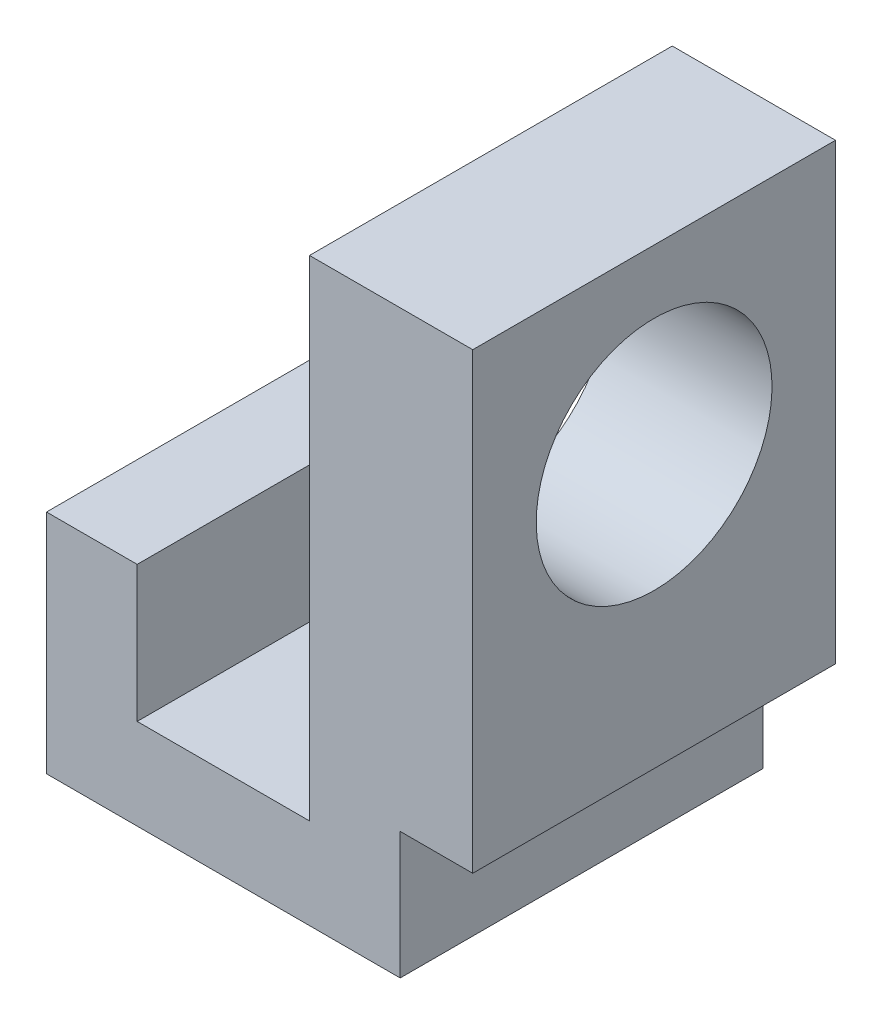
from build123d import *

# Parameters (mm, degrees)
BOSS_EXTRUDE1_DEPTH = 40
SKETCH2_R           = 13
CUT_EXTRUDE1_DEPTH  = 18


with BuildPart() as part:
    # Sketch1 → Boss-Extrude1 (new body)
    with BuildSketch(Plane.XY):
        Polygon((0, 0), (39, 0), (39, 14), (47, 14), (47, 64), (29, 64), (29, 10), (10, 10), (10, 25), (0, 25), align=None)
    extrude(amount=-BOSS_EXTRUDE1_DEPTH)

    # Sketch2 → Cut-Extrude1 (cut)
    with BuildSketch(Plane.ZY.offset(-29)):
        with Locations(Location((-20, 44, 0), (0, 0, 270))):
            Circle(SKETCH2_R)
    extrude(amount=-CUT_EXTRUDE1_DEPTH, mode=Mode.SUBTRACT)


solid = part.part
